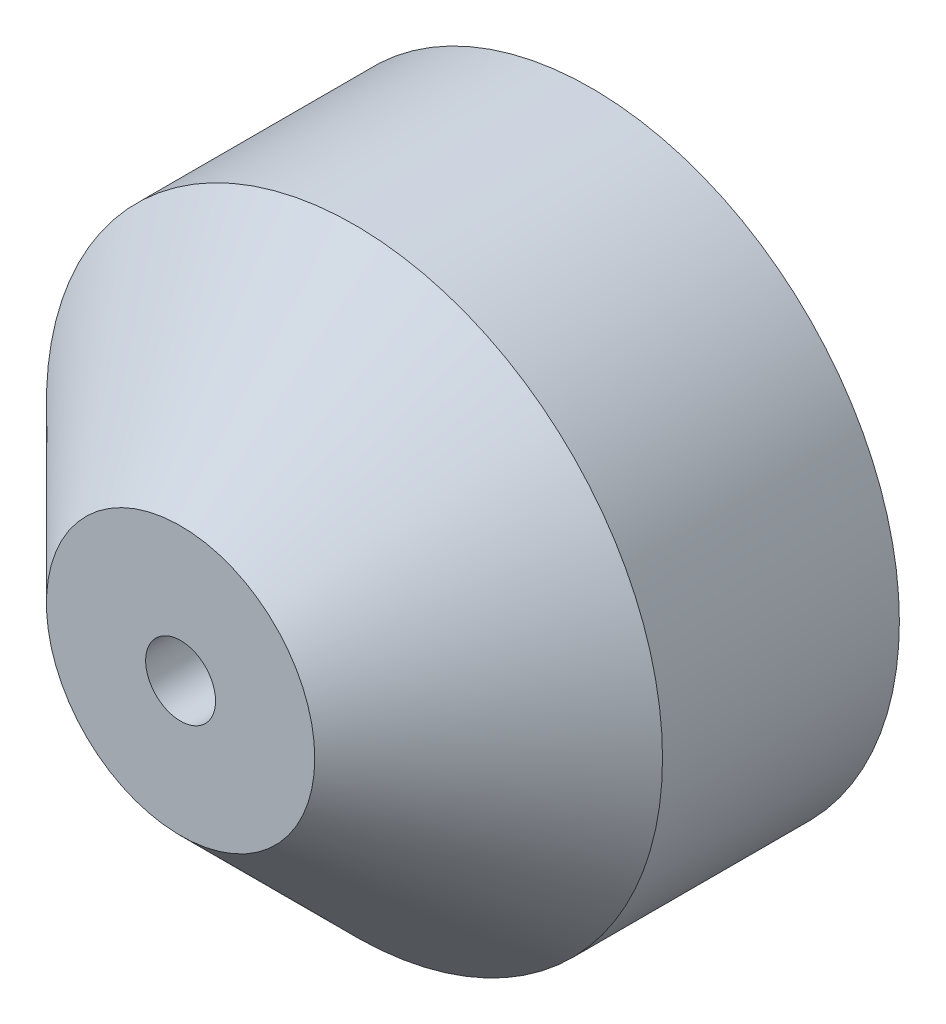
from build123d import *

# Parameters (mm, degrees)
SKETCH1_R               = 22.5
BOSS_EXTRUDE1_DEPTH     = 30
SKETCH2_R               = 17.5
CUT_EXTRUDE1_DEPTH      = 15
F_1_4_20_TAPPED_HOLE1_D = 5.1054
CHAMFER1_SIZE           = 12.7


with BuildPart() as part:
    # Sketch1 → Boss-Extrude1 (new body)
    with BuildSketch(Plane.XY):
        Circle(SKETCH1_R)
    extrude(amount=-BOSS_EXTRUDE1_DEPTH)

    # Sketch2 → Cut-Extrude1 (cut)
    with BuildSketch(Plane(origin=(0, 0, -30), x_dir=(-1, 0, 0), z_dir=(0, 0, -1))):
        Circle(SKETCH2_R)
    extrude(amount=-CUT_EXTRUDE1_DEPTH, mode=Mode.SUBTRACT)

    # 1/4-20 Tapped Hole1 (through all)
    with Locations(Plane.XY):
        with Locations((0, 0)):
            Hole(F_1_4_20_TAPPED_HOLE1_D / 2)

    # Chamfer1
    chamfer1_edges = [part.edges().sort_by_distance(p)[0] for p in [
        (-22.5, 0, 0),
    ]]
    chamfer(chamfer1_edges, length=CHAMFER1_SIZE)


solid = part.part
